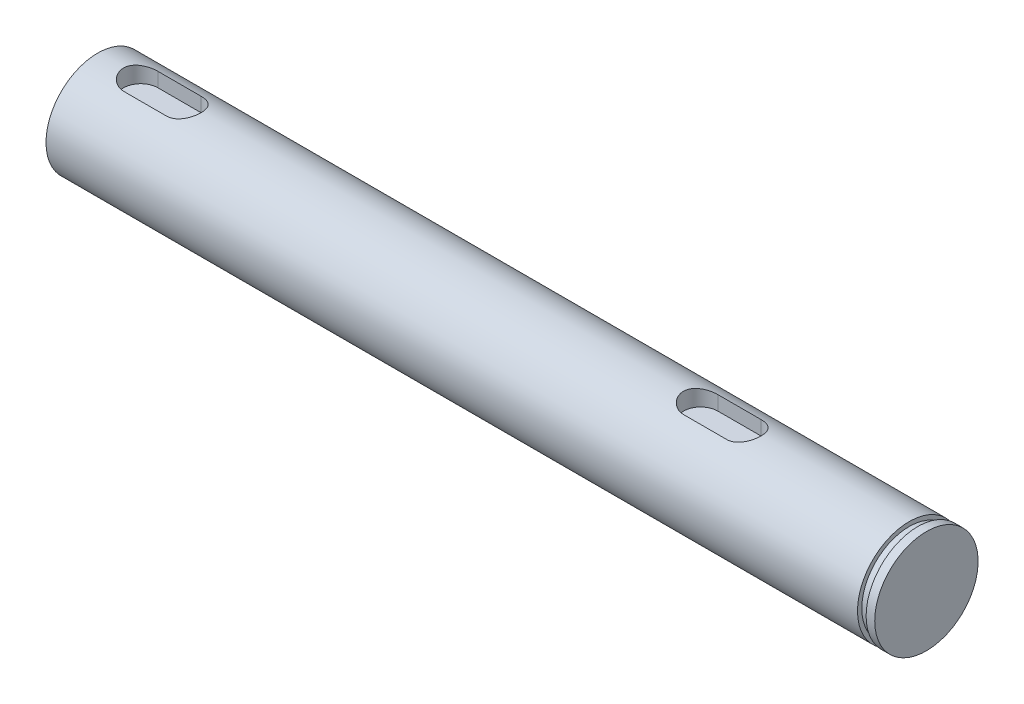
from build123d import *

# Parameters (mm, degrees)
CUT_EXTRUDE_1_DEPTH = 2


with BuildPart() as part:
    # ｽｹｯﾁ2 → 回転1 (revolve)
    with BuildSketch(Plane.XY, mode=Mode.PRIVATE) as revolve_1_sk:
        Polygon((0, 6), (0, 0), (96.2, 0), (96.2, 6), (95.2, 6), (95.2, 5.5), (94.2, 5.5), (94.2, 6), (2, 6), (1, 6), align=None)
    revolve(revolve_1_sk.sketch.rotate(Axis((0, 0, 0), (1, 0, 0)), 90), axis=Axis((0, 0, 0), (1, 0, 0)))

    # ｽｹｯﾁ4 → ｶｯﾄ - 押し出し1 (cut)
    with BuildSketch(Plane(origin=(0, 6, 0), x_dir=(1, 0, 0), z_dir=(0, 1, 0))):
        with BuildLine():
            Line((5, 2), (10, 2))
            ThreePointArc((10, 2), (12, 0), (10, -2))
            Line((10, -2), (5, -2))
            ThreePointArc((5, -2), (3, 0), (5, 2))
        make_face()
        with BuildLine():
            Line((75, -2), (70, -2))
            ThreePointArc((70, -2), (68, 0), (70, 2))
            Line((70, 2), (75, 2))
            ThreePointArc((75, 2), (77, 0), (75, -2))
        make_face()
    extrude(amount=-CUT_EXTRUDE_1_DEPTH, mode=Mode.SUBTRACT)


solid = part.part
